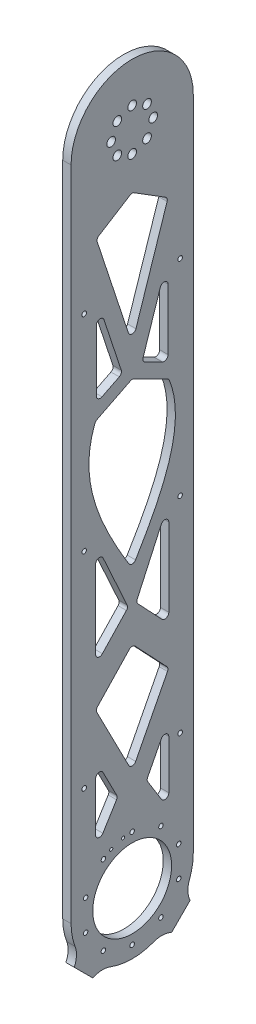
from build123d import *

# Parameters (mm, degrees)
SKETCH1_R                            = 3.3
SKETCH1_R_2                          = 1.7
SKETCH1_R_3                          = 26
BOSS_EXTRUDE1_DEPTH                  = 6.35
CUT_EXTRUDE1_DEPTH                   = 549.511460682
FILLET1_R                            = 3
SKETCH4_R                            = 1.75
CUT_EXTRUDE2_DEPTH                   = 549.511460792
SKETCH5_R                            = 1.2
CUT_EXTRUDE4_DEPTH                   = 549.511460792
BOSS_EXTRUDE2_START                  = -6.35
BOSS_EXTRUDE2_DEPTH                  = 6.35
TAP_DRILL_FOR_M3X0_5_TAP1_AT_2_COUNT = 2
TAP_DRILL_FOR_M3X0_5_TAP1_AT_2_PITCH = 13.03070812
CIRPATTERN1_COUNT                    = 2
CIRPATTERN1_ANGLE                    = 90
SKETCH10_R                           = 30
CUT_EXTRUDE6_DEPTH                   = 549.511460792


with BuildPart() as part:
    # Sketch1 → Boss-Extrude1 (new body)
    with BuildSketch(Plane(origin=(0, 0, 0), x_dir=(0, -1, 0), z_dir=(1, 0, 0))):
        with BuildLine():
            Line((0, 46.5), (500, 46.5))
            ThreePointArc((500, 46.5), (546.5, 0), (500, -46.5))
            Line((500, -46.5), (0, -46.5))
            ThreePointArc((0, -46.5), (-46.5, 0), (0, 46.5))
        make_face()
        with Locations(Location((-16, 0, 0), (0, 0, 90))):
            Circle(SKETCH1_R, mode=Mode.SUBTRACT)
        with Locations(Location((-11.313708499, 11.313708499, 0), (0, 0, 90))):
            Circle(SKETCH1_R, mode=Mode.SUBTRACT)
        with Locations(Location((0, 16, 0), (0, 0, 90))):
            Circle(SKETCH1_R, mode=Mode.SUBTRACT)
        with Locations(Location((11.313708499, 11.313708499, 0), (0, 0, 90))):
            Circle(SKETCH1_R, mode=Mode.SUBTRACT)
        with Locations(Location((16, 0, 0), (0, 0, 90))):
            Circle(SKETCH1_R, mode=Mode.SUBTRACT)
        with Locations(Location((11.313708499, -11.313708499, 0), (0, 0, 90))):
            Circle(SKETCH1_R, mode=Mode.SUBTRACT)
        with Locations(Location((537.25, 0, 0), (0, 0, 90))):
            Circle(SKETCH1_R_2, mode=Mode.SUBTRACT)
        with Locations(Location((530.13588304, -21.895000648, 0), (0, 0, 90))):
            Circle(SKETCH1_R_2, mode=Mode.SUBTRACT)
        with Locations(Location((511.51088304, -35.426855232, 0), (0, 0, 90))):
            Circle(SKETCH1_R_2, mode=Mode.SUBTRACT)
        with Locations(Location((488.48911696, -35.426855232, 0), (0, 0, 90))):
            Circle(SKETCH1_R_2, mode=Mode.SUBTRACT)
        with Locations(Location((469.86411696, -21.895000648, 0), (0, 0, 90))):
            Circle(SKETCH1_R_2, mode=Mode.SUBTRACT)
        with Locations(Location((462.75, 0, 0), (0, 0, 90))):
            Circle(SKETCH1_R_2, mode=Mode.SUBTRACT)
        with Locations(Location((469.86411696, 21.895000648, 0), (0, 0, 90))):
            Circle(SKETCH1_R_2, mode=Mode.SUBTRACT)
        with Locations(Location((488.48911696, 35.426855232, 0), (0, 0, 90))):
            Circle(SKETCH1_R_2, mode=Mode.SUBTRACT)
        with Locations(Location((511.51088304, 35.426855232, 0), (0, 0, 90))):
            Circle(SKETCH1_R_2, mode=Mode.SUBTRACT)
        with Locations(Location((530.13588304, 21.895000648, 0), (0, 0, 90))):
            Circle(SKETCH1_R_2, mode=Mode.SUBTRACT)
        with Locations(Location((500, 0, 0), (0, 0, 90))):
            Circle(SKETCH1_R_3, mode=Mode.SUBTRACT)
        with Locations(Location((0, -16, 0), (0, 0, 90))):
            Circle(SKETCH1_R, mode=Mode.SUBTRACT)
        with Locations(Location((-11.313708499, -11.313708499, 0), (0, 0, 90))):
            Circle(SKETCH1_R, mode=Mode.SUBTRACT)
    extrude(amount=BOSS_EXTRUDE1_DEPTH)

    # Sketch3 → Cut-Extrude1 (cut, through all)
    with BuildSketch(Plane(origin=(6.35, 0, 0), x_dir=(0, 0, -1), z_dir=(1, 0, 0))):
        Polygon((0, -422.848022722), (27.858212922, -368.632839363), (0, -339.139268075), (-27.858212922, -368.632839363), align=None)
        Polygon((0, -41.368651369), (-27.312924288, -58.435222232), (0, -141.248998295), (27.312924288, -58.435222232), align=None)
        Polygon((3, -313.189087212), (27.858212922, -339.506549748), (27.858212922, -258.646044282), align=None)
        Polygon((-27.858212922, -339.506549748), (-27.858212922, -258.646044282), (-3, -313.189087212), align=None)
        Polygon((-27.858212922, -401.452857349), (-11, -434.260816252), (-27.858212922, -461.481824785), align=None)
        Polygon((11, -434.260816252), (27.858212922, -461.481824785), (27.858212922, -401.452857349), align=None)
        with BuildLine():
            Line((0, -164.248853344), (-27.858212922, -178.200474573))
            add(Edge.make_bspline(
                [(-27.858212922, -178.200474573), (-43.7790539, -216.093343216), (-18.61661693, -258.276071598), (0, -289.085024731)],
                knots=[0, 0, 0, 0, 1, 1, 1, 1], degree=3))
            add(Edge.make_bspline(
                [(27.858212922, -178.200474573), (43.7790539, -216.093343216), (18.61661693, -258.276071598), (0, -289.085024731)],
                knots=[0, 0, 0, 0, 1, 1, 1, 1], degree=3))
            Line((27.858212922, -178.200474573), (0, -164.248853344))
        make_face()
        Polygon((7.5, -156.820958214), (27.312924288, -96.747453897), (27.312924288, -166.743432993), align=None)
        Polygon((-27.312924288, -96.747453897), (-27.312924288, -166.743432993), (-7.5, -156.820958214), align=None)
    extrude(amount=-CUT_EXTRUDE1_DEPTH, mode=Mode.SUBTRACT)

    # Fillet1
    fillet1_edges = [part.edges().sort_by_distance(p)[0] for p in [
        (3.175, -58.435222232, -27.312924288),
        (3.175, -41.368651369, 0),
        (3.175, -58.435222232, 27.312924288),
        (3.175, -141.248998295, 0),
        (3.175, -289.085024731, 0),
        (3.175, -164.248853344, 0),
        (3.175, -401.452857349, 27.858212922),
        (3.175, -434.260816252, 11),
        (3.175, -461.481824785, 27.858212922),
        (3.175, -461.481824785, -27.858212922),
        (3.175, -434.260816252, -11),
        (3.175, -401.452857349, -27.858212922),
        (3.175, -368.632839363, -27.858212922),
        (3.175, -339.139268075, 0),
        (3.175, -368.632839363, 27.858212922),
        (3.175, -422.848022722, 0),
        (3.175, -313.189087212, 3),
        (3.175, -339.506549748, 27.858212922),
        (3.175, -258.646044282, 27.858212922),
        (3.175, -178.200474573, -27.858212922),
        (3.175, -178.200474573, 27.858212922),
        (3.175, -339.506549748, -27.858212922),
        (3.175, -313.189087212, -3),
        (3.175, -258.646044282, -27.858212922),
        (3.175, -96.747453897, 27.312924288),
        (3.175, -166.743432993, 27.312924288),
        (3.175, -156.820958214, 7.5),
        (3.175, -166.743432993, -27.312924288),
        (3.175, -156.820958214, -7.5),
        (3.175, -96.747453897, -27.312924288),
    ]]
    fillet(fillet1_edges, radius=FILLET1_R)

    # Sketch4 → Cut-Extrude2 (cut, through all)
    with BuildSketch(Plane(origin=(6.35, 0, 0), x_dir=(0, 0, -1), z_dir=(1, 0, 0))):
        with Locations((-36.5, -103.175)):
            Circle(SKETCH4_R)
        with Locations(Location((36.5, -103.175, 0), (0, 0, 180))):
            Circle(SKETCH4_R)
        with Locations(Location((-36.5, -259.525, 0), (0, 0, 180))):
            Circle(SKETCH4_R)
        with Locations((36.5, -259.525)):
            Circle(SKETCH4_R)
        with Locations((-36.5, -415.875)):
            Circle(SKETCH4_R)
        with Locations(Location((36.5, -415.875, 0), (0, 0, 180))):
            Circle(SKETCH4_R)
    extrude(amount=-CUT_EXTRUDE2_DEPTH, mode=Mode.SUBTRACT)

    # Sketch5 → Cut-Extrude4 (cut, through all)
    with BuildSketch(Plane(origin=(6.35, 0, 0), x_dir=(0, 0, -1), z_dir=(1, 0, 0))):
        with Locations((-6.916110339, -463.343078174)):
            Circle(SKETCH5_R)
        with Locations((-15.951147244, -466.27873962)):
            Circle(SKETCH5_R)
    extrude(amount=-CUT_EXTRUDE4_DEPTH, mode=Mode.SUBTRACT)

    # Sketch6 → Boss-Extrude2 (add)
    with BuildSketch(Plane(origin=(6.35, 0, 0), x_dir=(0, 0, -1), z_dir=(1, 0, 0)).offset(BOSS_EXTRUDE2_START)):
        with BuildLine():
            Line((-44.110383395, -529.968247771), (-29.968247771, -544.110383395))
            ThreePointArc((-29.968247771, -544.110383395), (-23.286397782, -542.399293624), (-16.474718596, -543.483717035))
            ThreePointArc((-16.474718596, -543.483717035), (-32.880465325, -532.880465325), (-43.483717035, -516.474718596))
            ThreePointArc((-43.483717035, -516.474718596), (-42.399293624, -523.286397782), (-44.110383395, -529.968247771))
        make_face()
    boss_extrude2 = extrude(amount=BOSS_EXTRUDE2_DEPTH)

    # Sketch8 → Tap Drill for M3x0.5 Tap1 (revolve, cut)
    with BuildSketch(Plane(origin=(3.175, -532.796674896, 41.28195627), x_dir=(0, -0.7071067811865424, -0.7071067811865527), z_dir=(1, 0, 0))):
        Polygon((0, 0), (0, 5.751075774), (1.25, 5), (1.25, 0), align=None)
    tap_drill_for_m3x0_5_tap1 = revolve(axis=Axis((3.175, -537.286802956, 45.772084331), (0, 0.7071067811865529, -0.7071067811865422)), mode=Mode.SUBTRACT)

    # Tap Drill for M3x0.5 Tap1 at 2: Tap Drill for M3x0.5 Tap1 ×2
    with Locations(*[Vector(0, -0.7071067811865422, -0.7071067811865529) * (i * TAP_DRILL_FOR_M3X0_5_TAP1_AT_2_PITCH) for i in range(1, TAP_DRILL_FOR_M3X0_5_TAP1_AT_2_COUNT)]):
        add(tap_drill_for_m3x0_5_tap1, mode=Mode.SUBTRACT)

    # CirPattern1: Boss-Extrude2, Tap Drill for M3x0.5 Tap1 ×2 about axis
    cirpattern1_axis = Axis((0, -500, 0), (1, 0, 0))
    add([boss_extrude2.rotate(cirpattern1_axis, i * CIRPATTERN1_ANGLE / (CIRPATTERN1_COUNT - 1)) for i in range(1, CIRPATTERN1_COUNT)])
    add([tap_drill_for_m3x0_5_tap1.rotate(cirpattern1_axis, i * CIRPATTERN1_ANGLE / (CIRPATTERN1_COUNT - 1)) for i in range(1, CIRPATTERN1_COUNT)], mode=Mode.SUBTRACT)

    # CirPattern1 copy 1 sketch → CirPattern1 copy 1 (revolve, cut)
    with BuildSketch(Plane(origin=(3.175, -532.067854195, -42.010776971), x_dir=(0, 0.7071067811865551, -0.7071067811865399), z_dir=(1, 0, 0))):
        Polygon((0, 0), (0, 5.751075774), (1.25, 5), (1.25, 0), align=None)
    revolve(axis=Axis((3.175, -536.557982255, -46.500905032), (0, 0.7071067811865398, 0.7071067811865553)), mode=Mode.SUBTRACT)

    # Sketch10 → Cut-Extrude6 (cut, through all)
    with BuildSketch(Plane(origin=(6.35, 0, 0), x_dir=(0, 0, -1), z_dir=(1, 0, 0))):
        with Locations((0, -500)):
            Circle(SKETCH10_R)
    extrude(amount=-CUT_EXTRUDE6_DEPTH, mode=Mode.SUBTRACT)


solid = part.part
